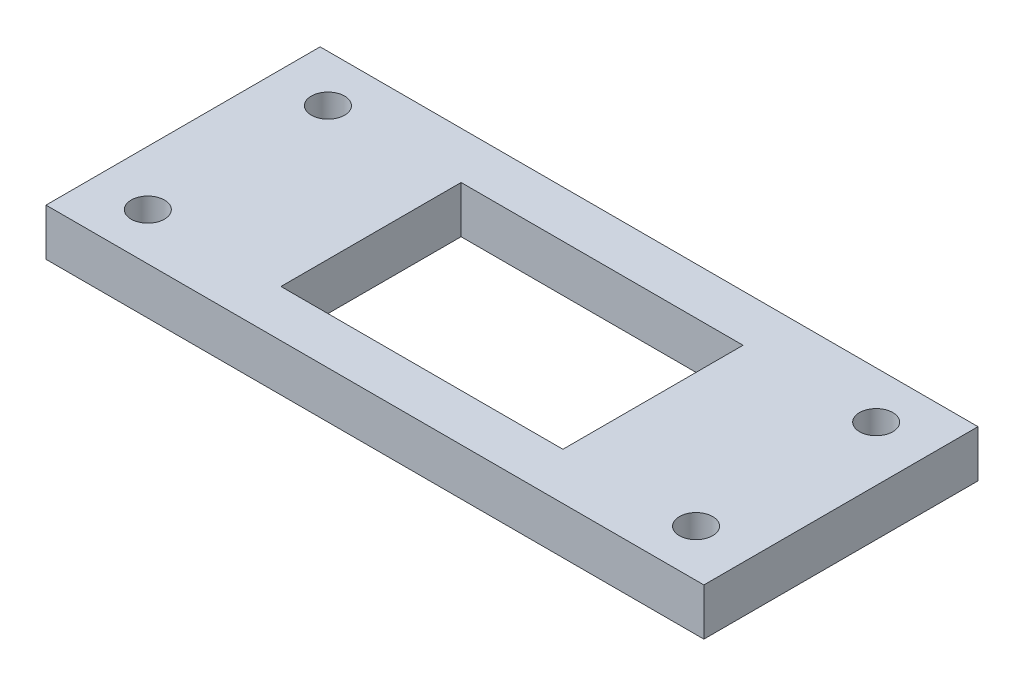
from build123d import *

# Parameters (mm, degrees)
SKETCH1_W                  = 168
SKETCH1_H                  = 70
SKETCH1_R                  = 4.25
SKETCH1_W_2                = 72
SKETCH1_H_2                = 46
BRIDGE_CLAMP_EXTRUDE_DEPTH = 12


with BuildPart() as part:
    # Sketch1 → Bridge_Clamp_Extrude (new body)
    with BuildSketch(Plane(origin=(0, 0, 0), x_dir=(1, 0, 0), z_dir=(0, 1, 0))):
        Rectangle(SKETCH1_W, SKETCH1_H)
        with Locations(Location((-70, -23, 0), (0, 0, 270))):
            Circle(SKETCH1_R, mode=Mode.SUBTRACT)
        with Locations(Location((70, -23, 0), (0, 0, 270))):
            Circle(SKETCH1_R, mode=Mode.SUBTRACT)
        with Locations(Location((-70, 23, 0), (0, 0, 270))):
            Circle(SKETCH1_R, mode=Mode.SUBTRACT)
        with Locations(Location((70, 23, 0), (0, 0, 270))):
            Circle(SKETCH1_R, mode=Mode.SUBTRACT)
        Rectangle(SKETCH1_W_2, SKETCH1_H_2, mode=Mode.SUBTRACT)
    extrude(amount=BRIDGE_CLAMP_EXTRUDE_DEPTH)


solid = part.part
